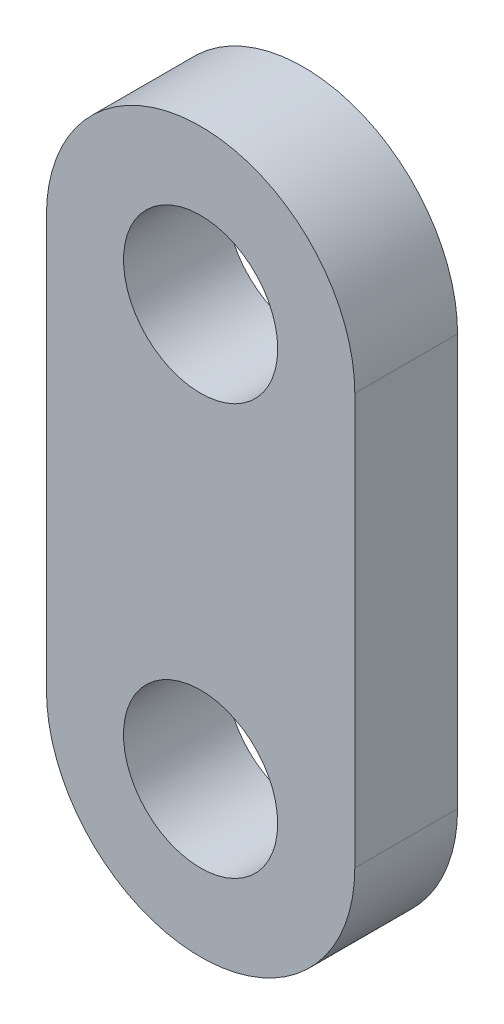
from build123d import *

# Parameters (mm, degrees)
SKETCH1_R           = 4.7625
SKETCH1_R_2         = 2.38125
BOSS_EXTRUDE1_DEPTH = 3.175


with BuildPart() as part:
    # Sketch1 → Boss-Extrude1 (new body)
    # profile 1 of 3: a face of its own
    with BuildSketch(Plane.XY):
        with BuildLine():
            Line((-4.7625, 12.7), (-4.7625, 0))
            ThreePointArc((-4.7625, 0), (0, 4.7625), (4.7625, 0))
            Line((4.7625, 0), (4.7625, 12.7))
            ThreePointArc((4.7625, 12.7), (0, 7.9375), (-4.7625, 12.7))
        make_face()
    # profile 2 of 3: a face of its own
    with BuildSketch(Plane.XY):
        with Locations((0, 12.7)):
            Circle(SKETCH1_R)
        with Locations((0, 12.7)):
            Circle(SKETCH1_R_2, mode=Mode.SUBTRACT)
    # profile 3 of 3: a face of its own
    with BuildSketch(Plane.XY):
        Circle(SKETCH1_R)
        Circle(SKETCH1_R_2, mode=Mode.SUBTRACT)
    extrude(amount=BOSS_EXTRUDE1_DEPTH)


solid = part.part
